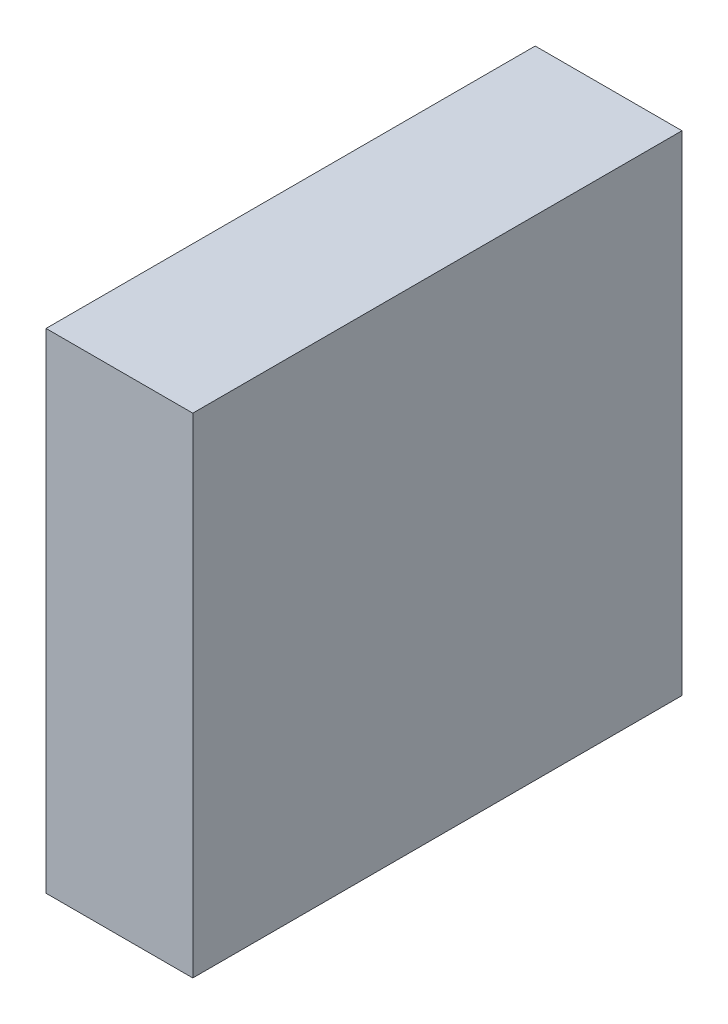
from build123d import *

# Parameters (mm, degrees)
SKETCH1_W           = 3
SKETCH1_H           = 3
BOSS_EXTRUDE1_DEPTH = 0.9


with BuildPart() as part:
    # Sketch1 → Boss-Extrude1 (new body)
    with BuildSketch(Plane(origin=(0, 0, 0), x_dir=(0, 0, -1), z_dir=(1, 0, 0))):
        Rectangle(SKETCH1_W, SKETCH1_H)
    extrude(amount=BOSS_EXTRUDE1_DEPTH)


solid = part.part
